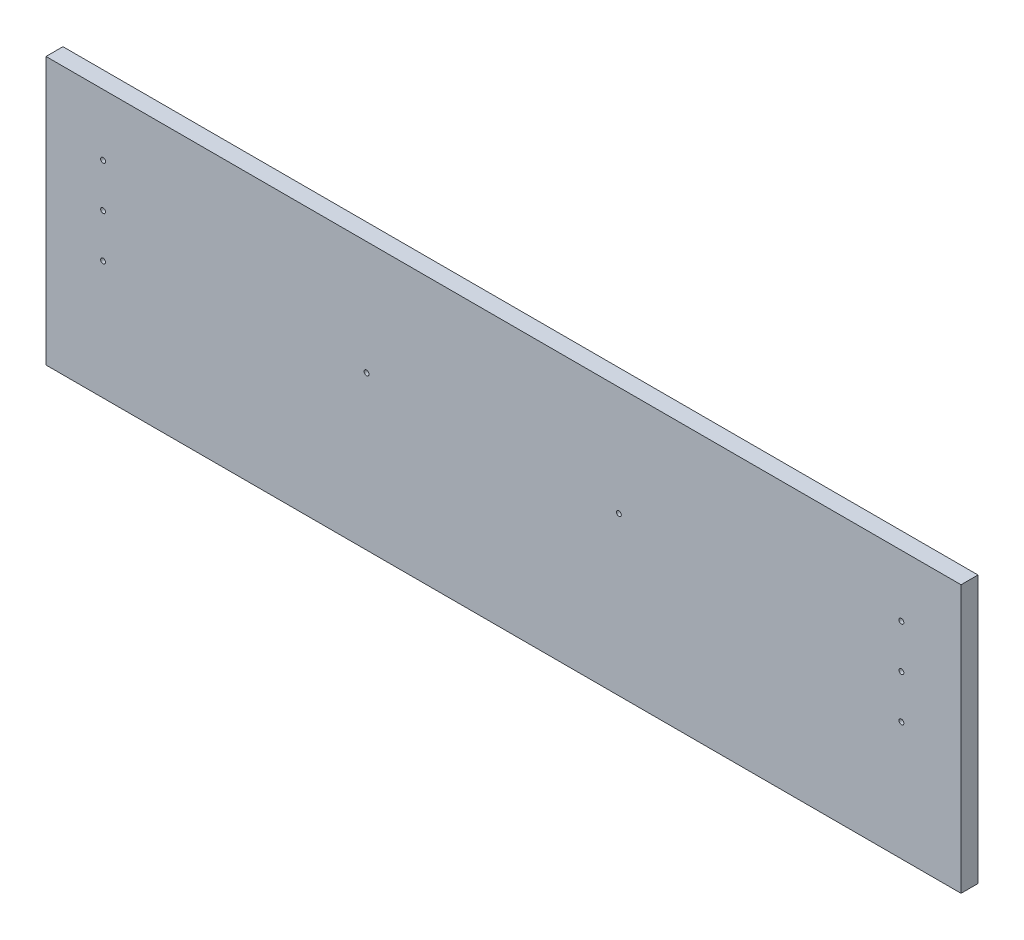
from build123d import *

# Parameters (mm, degrees)
SKETCH1_W                = 1025.461280364
SKETCH1_H                = 299.5
BOSS_EXTRUDE1_DEPTH      = 19
M5_CLEARANCE_HOLE1_D     = 5.5
M5_CLEARANCE_HOLE1_DEPTH = 32.347633298
M5_CLEARANCE_HOLE1_TIP   = 1.652366702


with BuildPart() as part:
    # Sketch1 → Boss-Extrude1 (new body)
    with BuildSketch(Plane.XY):
        with Locations((-1353.189241506, 653.485981281)):
            Rectangle(SKETCH1_W, SKETCH1_H)
    extrude(amount=BOSS_EXTRUDE1_DEPTH)

    # M5 Clearance Hole1
    with Locations(Plane(origin=(-1324.198298443, -38.252881002, 0), x_dir=(1, 0, 0), z_dir=(0, 0, -1))):
        with Locations((-477.744666278, -772.719190614), (-477.744666278, -723.853749178), (-477.744666278, -674.983749963), (416.87696419, -772.719190614), (416.87696419, -723.848749963), (416.87696419, -674.989194818), (100.235099038, -718.93253129), (-182.477682784, -714.015727285)):
            Hole(M5_CLEARANCE_HOLE1_D / 2, depth=M5_CLEARANCE_HOLE1_DEPTH)
            with Locations((0, 0, -(M5_CLEARANCE_HOLE1_DEPTH + M5_CLEARANCE_HOLE1_TIP / 2))):  # 118° drill point
                Cone(0, M5_CLEARANCE_HOLE1_D / 2, M5_CLEARANCE_HOLE1_TIP, mode=Mode.SUBTRACT)


solid = part.part
